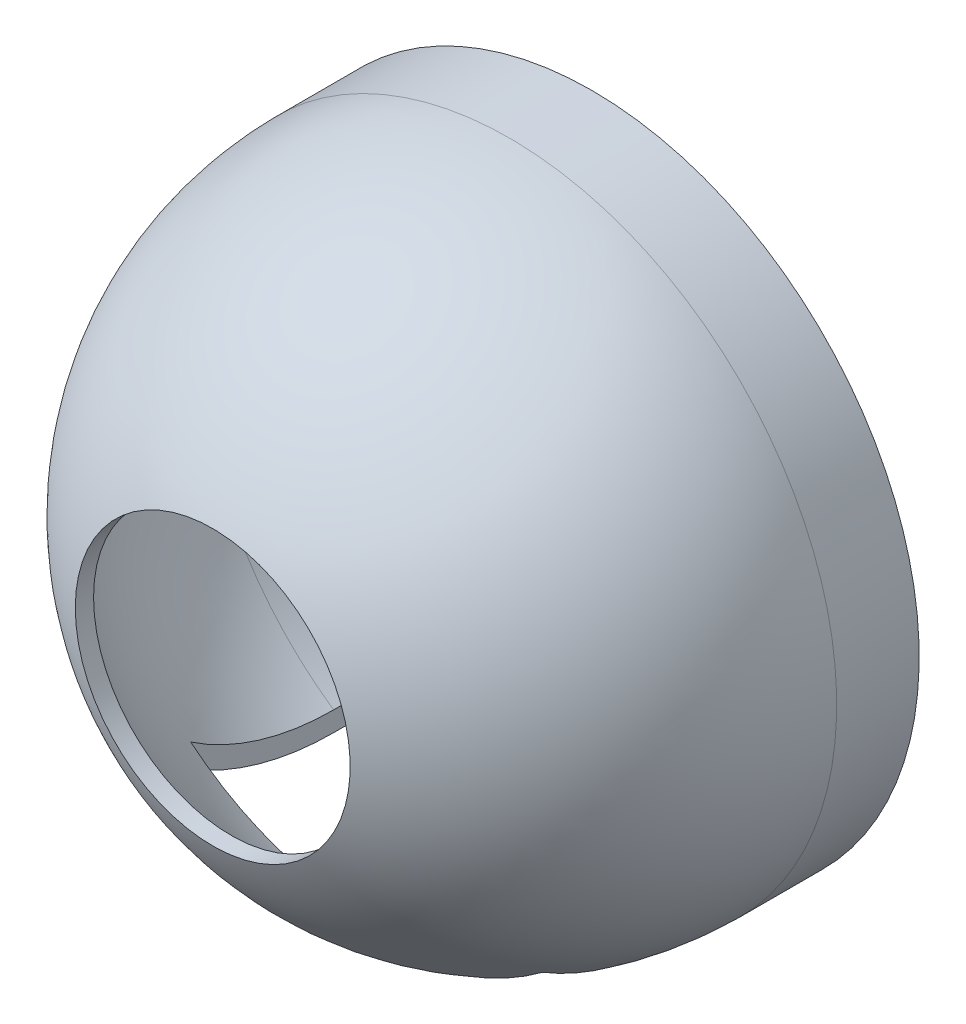
from build123d import *

# Parameters (mm, degrees)
SHELL1_T           = 3
SKETCH5_R          = 25
CUT_EXTRUDE3_DEPTH = 170.883652636
SKETCH6_W          = 64
SKETCH6_H          = 41
CUT_EXTRUDE4_DEPTH = 170.883652636


with BuildPart() as part:
    # Sketch2 → Revolve1 (revolve)
    with BuildSketch(Plane(origin=(0, 0, 0), x_dir=(0, 0, -1), z_dir=(1, 0, 0)), mode=Mode.PRIVATE) as revolve1_sk:
        with BuildLine():
            Line((76.080335522, 0), (147.580335522, 0))
            Line((147.580335522, 0), (147.580335522, 56.5))
            Line((147.580335522, 56.5), (132.580335522, 56.5))
            ThreePointArc((132.580335522, 56.5), (92.628802385, 39.951533137), (76.080335522, 0))
        make_face()
    revolve(revolve1_sk.sketch.rotate(Axis((0, 0, -76.080335522), (0, 0, 1)), 90), axis=Axis((0, 0, -76.080335522), (0, 0, 1)))

    # Shell1
    shell1_openings = [part.faces().sort_by_distance(p)[0] for p in [
        (0, 0, -147.580335522),
    ]]
    offset(amount=SHELL1_T, openings=shell1_openings, kind=Kind.INTERSECTION)

    # Sketch5 → Cut-Extrude3 (cut, through all)
    with BuildSketch(Plane.XY):
        with Locations(Location((0, 0, 0), (0, 0, 180))):
            Circle(SKETCH5_R)
    extrude(amount=-CUT_EXTRUDE3_DEPTH, mode=Mode.SUBTRACT)

    # Sketch6 → Cut-Extrude4 (cut, through all)
    with BuildSketch(Plane(origin=(0, 0, 0), x_dir=(1, 0, 0), z_dir=(0, 1, 0))):
        with Locations((0, 127.080335522)):
            Rectangle(SKETCH6_W, SKETCH6_H)
    extrude(amount=-CUT_EXTRUDE4_DEPTH, mode=Mode.SUBTRACT)


solid = part.part
